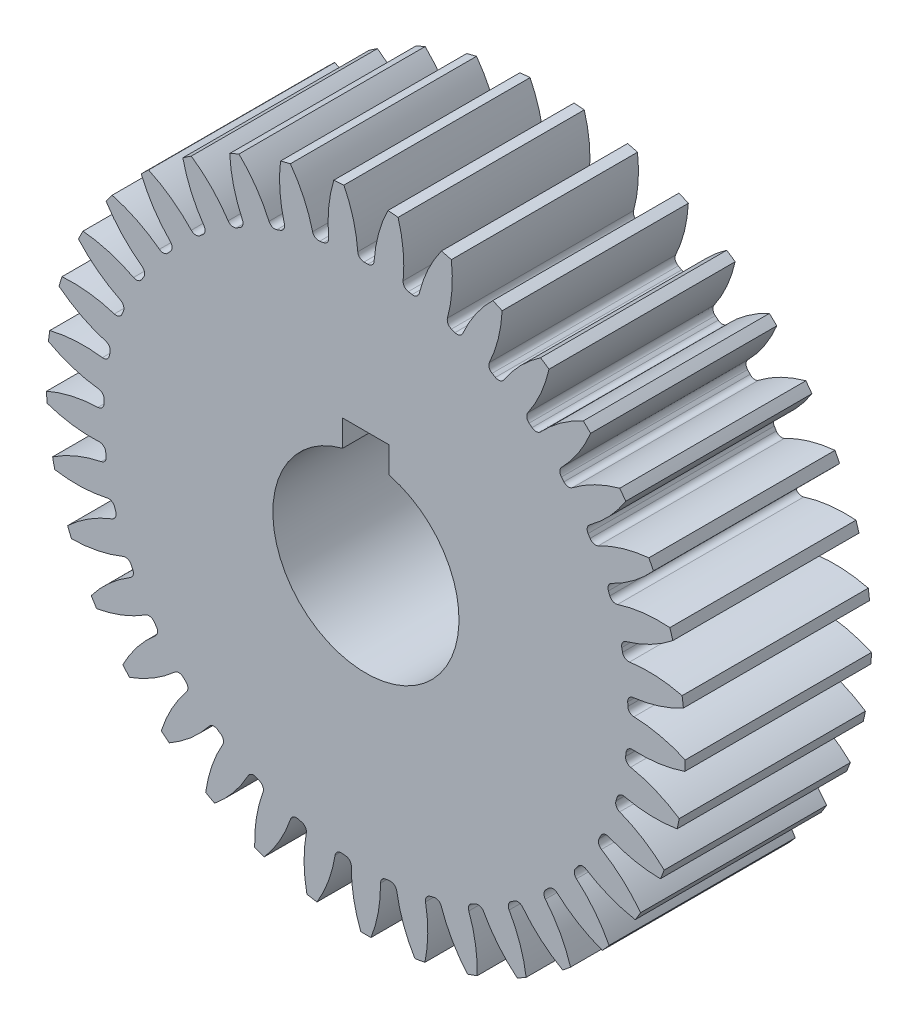
from build123d import *

# Parameters (mm, degrees)
SKETCH1_R                = 34.32
SKETCH1_R_2              = 10
BOSS_EXTRUDE2_DEPTH      = 20
CUT_EXTRUDE1_DEPTH       = 53.494997857
FILLET1_R                = 0.6688
CIRPATTERN1_COUNT        = 37
FILLET1_OF_CIRPATTERN1_R = 0.6688
CUT_EXTRUDE2_DEPTH       = 53.487136712


with BuildPart() as part:
    # Sketch1 → Boss-Extrude2 (new body)
    with BuildSketch(Plane(origin=(0, 0, 0), x_dir=(0, 1, 0), z_dir=(0, 0, 1))):
        with Locations(Location((0, 0, 0), (0, 0, 270))):
            Circle(SKETCH1_R)
        with Locations(Location((0, 0, 0), (0, 0, 270))):
            Circle(SKETCH1_R_2, mode=Mode.SUBTRACT)
    extrude(amount=BOSS_EXTRUDE2_DEPTH)

    # Sketch2 → Cut-Extrude1 (cut, through all)
    with BuildSketch(Plane.XY.offset(20)):
        with BuildLine():
            ThreePointArc((-0.845008629, 28.147318885), (-1.276717695, 31.274602726), (-2.363712046, 34.238505595))
            ThreePointArc((-2.363712046, 34.238505595), (0, 34.32), (2.363712046, 34.238505595))
            ThreePointArc((2.363712046, 34.238505595), (1.276717695, 31.274602726), (0.845008629, 28.147318885))
            ThreePointArc((0.845008629, 28.147318885), (0, 28.16), (-0.845008629, 28.147318885))
        make_face()
    cut_extrude1 = extrude(amount=-CUT_EXTRUDE1_DEPTH, mode=Mode.SUBTRACT)

    # Fillet1
    fillet1_edges = [part.edges().sort_by_distance(p)[0] for p in [
        (0.845008629, 28.147318885, 10),
        (-0.845008629, 28.147318885, 10),
    ]]
    fillet(fillet1_edges, radius=FILLET1_R)

    # CirPattern1: Cut-Extrude1 ×37 about axis
    cirpattern1_axis = Axis((0, 0, 0), (0, 0, 1))
    for i in range(1, CIRPATTERN1_COUNT):
        add(cut_extrude1.rotate(cirpattern1_axis, i * 360 / CIRPATTERN1_COUNT), mode=Mode.SUBTRACT)

    # Fillet1 of CirPattern1
    fillet1_of_cirpattern1_edges = [part.edges().sort_by_distance(p)[0] for p in [
        (-3.924066033, 27.885252478, 10),
        (-5.58977393, 27.599638175, 10),
        (-8.580252459, 26.820978128, 10),
        (-10.173731613, 26.257966126, 10),
        (-12.989600644, 24.98511307, 10),
        (-14.465009561, 24.160900199, 10),
        (-17.025261668, 22.430471799, 10),
        (-18.34015552, 21.368769162, 10),
        (-20.571136912, 19.230546694, 10),
        (-21.687688596, 17.961897543, 10),
        (-23.525218001, 15.477393773, 10),
        (-24.411306358, 14.038294835, 10),
        (-25.8025214, 11.278984413, 10),
        (-26.432655282, 9.710835944, 10),
        (-27.337533237, 6.756099207, 10),
        (-27.693584839, 5.104013983, 10),
        (-28.086094017, 2.038853327, 10),
        (-28.157820382, 0.350358833, 10),
        (-28.026669007, -2.73704665, 10),
        (-27.8120067, -4.413375503, 10),
        (-27.160967758, -7.434206779, 10),
        (-26.666092222, -9.050145061, 10),
        (-25.513894919, -11.917498314, 10),
        (-24.753042821, -13.426558423, 10),
        (-23.132833776, -16.057945121, 10),
        (-22.127893446, -17.416714146, 10),
        (-20.086283123, -19.736434083, 10),
        (-18.866164865, -20.905822712, 10),
        (-16.461886675, -22.847141771, 10),
        (-15.061691071, -23.793508823, 10),
        (-12.36391172, -25.300578787, 10),
        (-10.823919847, -25.996699005, 10),
        (-7.910249536, -27.026164217, 10),
        (-6.274764156, -27.452011489, 10),
        (-3.229023875, -27.974256108, 10),
        (-1.545094924, -28.117579584, 10),
        (1.545094924, -28.117579584, 10),
        (3.229023875, -27.974256108, 10),
        (6.274764156, -27.452011489, 10),
        (7.910249536, -27.026164217, 10),
        (10.823919847, -25.996699005, 10),
        (12.36391172, -25.300578787, 10),
        (15.061691071, -23.793508823, 10),
        (16.461886675, -22.847141771, 10),
        (18.866164865, -20.905822712, 10),
        (20.086283123, -19.736434083, 10),
        (22.127893446, -17.416714146, 10),
        (23.132833776, -16.057945121, 10),
        (24.753042821, -13.426558423, 10),
        (25.513894919, -11.917498314, 10),
        (26.666092222, -9.050145061, 10),
        (27.160967758, -7.434206779, 10),
        (27.8120067, -4.413375503, 10),
        (28.026669007, -2.73704665, 10),
        (28.157820382, 0.350358833, 10),
        (28.086094017, 2.038853327, 10),
        (27.693584839, 5.104013983, 10),
        (27.337533237, 6.756099207, 10),
        (26.432655282, 9.710835944, 10),
        (25.8025214, 11.278984413, 10),
        (24.411306358, 14.038294835, 10),
        (23.525218001, 15.477393773, 10),
        (21.687688596, 17.961897543, 10),
        (20.571136912, 19.230546694, 10),
        (18.34015552, 21.368769162, 10),
        (17.025261668, 22.430471799, 10),
        (14.465009561, 24.160900199, 10),
        (12.989600644, 24.98511307, 10),
        (10.173731613, 26.257966126, 10),
        (8.580252459, 26.820978128, 10),
        (5.58977393, 27.599638175, 10),
        (3.924066033, 27.885252478, 10),
    ]]
    fillet(fillet1_of_cirpattern1_edges, radius=FILLET1_OF_CIRPATTERN1_R)

    # Sketch3 → Cut-Extrude2 (cut, through all)
    with BuildSketch(Plane.XY.offset(20)):
        with BuildLine():
            Line((-2.5, 12.5), (2.5, 12.5))
            Line((2.5, 12.5), (2.5, 9.682458366))
            ThreePointArc((2.5, 9.682458366), (0, 10), (-2.5, 9.682458366))
            Line((-2.5, 9.682458366), (-2.5, 12.5))
        make_face()
    extrude(amount=-CUT_EXTRUDE2_DEPTH, mode=Mode.SUBTRACT)


solid = part.part
